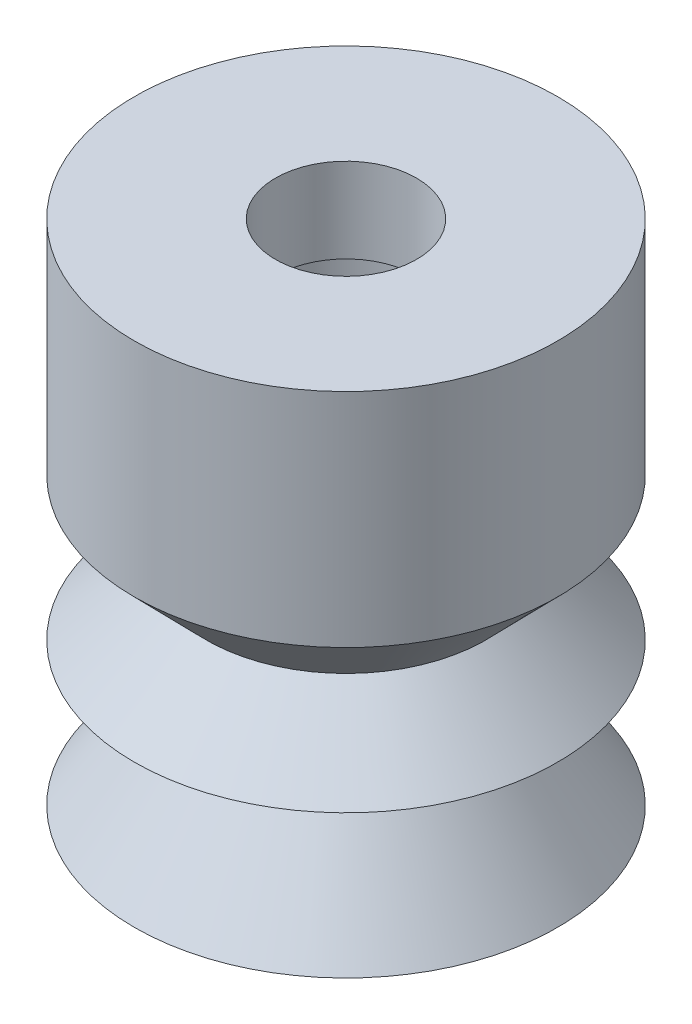
from build123d import *


with BuildPart() as part:
    # Esquisse1 → Révolution1 (revolve)
    with BuildSketch(Plane.XY, mode=Mode.PRIVATE) as r_volution1_sk:
        Polygon((-2.5, 18), (-7.5, 18), (-7.5, 10.141492036), (-4.951378463, 7.544225258), (-7.5, 5.070746018), (-4.951378463, 3.607027364), (-7.5, 0), (-7.336992764, 0), (-3.5, 3.607027364), (-6.048621537, 5.070746018), (-2, 9), (-2, 13), (-3.4, 13), (-3.4, 15), (-2.5, 15), align=None)
    revolve(r_volution1_sk.sketch.rotate(Axis((0, 0, 0), (0, 1, 0)), 270), axis=Axis((0, 0, 0), (0, 1, 0)))


solid = part.part
